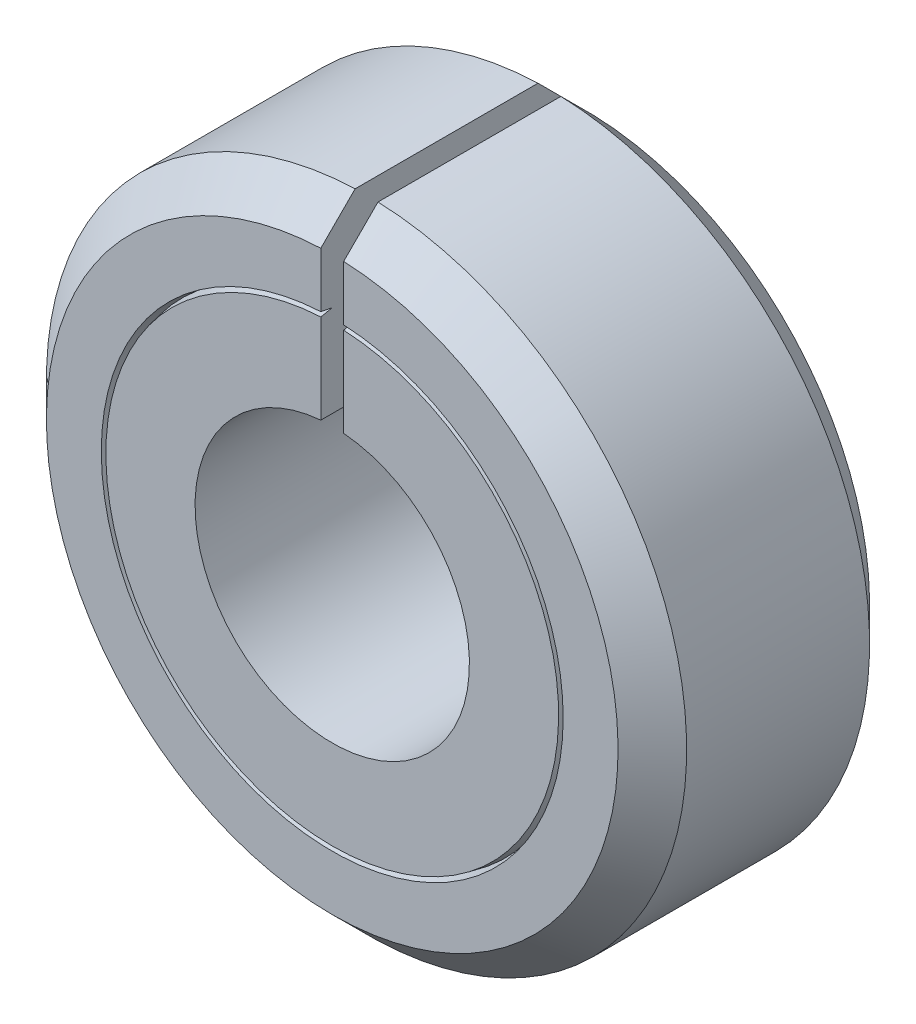
from build123d import *

# Parameters (mm, degrees)
SKETCH3_W          = 1
SKETCH3_H          = 14
CUT_EXTRUDE2_DEPTH = 15


with BuildPart() as part:
    # Sketch1 → Revolve1 (revolve)
    with BuildSketch(Plane(origin=(0, 0, 0), x_dir=(0, 0, -1), z_dir=(1, 0, 0)), mode=Mode.PRIVATE) as revolve1_sk:
        Polygon((-5.5, 6), (5.5, 6), (5.5, 9.9), (5, 10), (5.5, 10.1), (5.5, 12.5), (4, 14), (-4, 14), (-5.5, 12.5), (-5.5, 10.1), (-5, 10), (-5.5, 9.9), align=None)
    revolve(revolve1_sk.sketch.rotate(Axis((0, 0, 10.112306333), (0, 0, -1)), 90), axis=Axis((0, 0, 10.112306333), (0, 0, -1)))

    # Sketch3 → Cut-Extrude2 (cut, symmetric)
    with BuildSketch(Plane.XY):
        with Locations((0, 7)):
            Rectangle(SKETCH3_W, SKETCH3_H)
    extrude(amount=CUT_EXTRUDE2_DEPTH, both=True, mode=Mode.SUBTRACT)


solid = part.part
